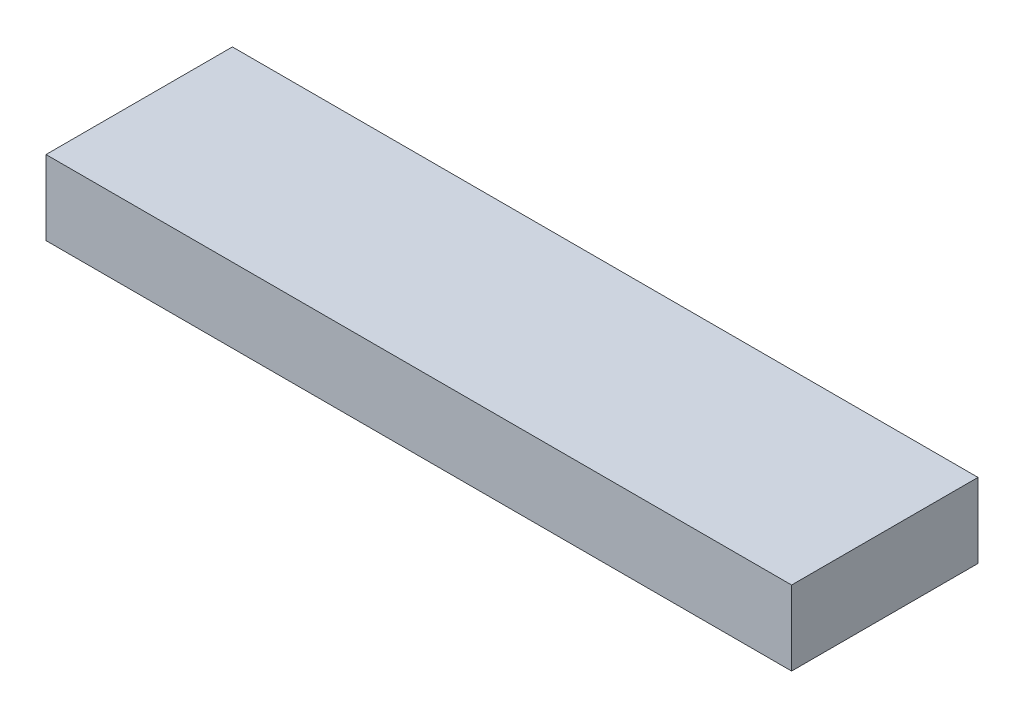
from build123d import *

# Parameters (mm, degrees)
SKETCH1_W           = 32
SKETCH1_H           = 8
BOSS_EXTRUDE1_DEPTH = 3.2
SHELL1_T            = -1.6


with BuildPart() as part:
    # Sketch1 → Boss-Extrude1 (new body)
    with BuildSketch(Plane(origin=(0, 0, 0), x_dir=(1, 0, 0), z_dir=(0, 1, 0))):
        with Locations((16, 4)):
            Rectangle(SKETCH1_W, SKETCH1_H)
    extrude(amount=BOSS_EXTRUDE1_DEPTH)

    # Shell1
    shell1_openings = [part.faces().sort_by_distance(p)[0] for p in [
        (16, 0, -4),
    ]]
    offset(amount=SHELL1_T, openings=shell1_openings, kind=Kind.INTERSECTION)


solid = part.part
